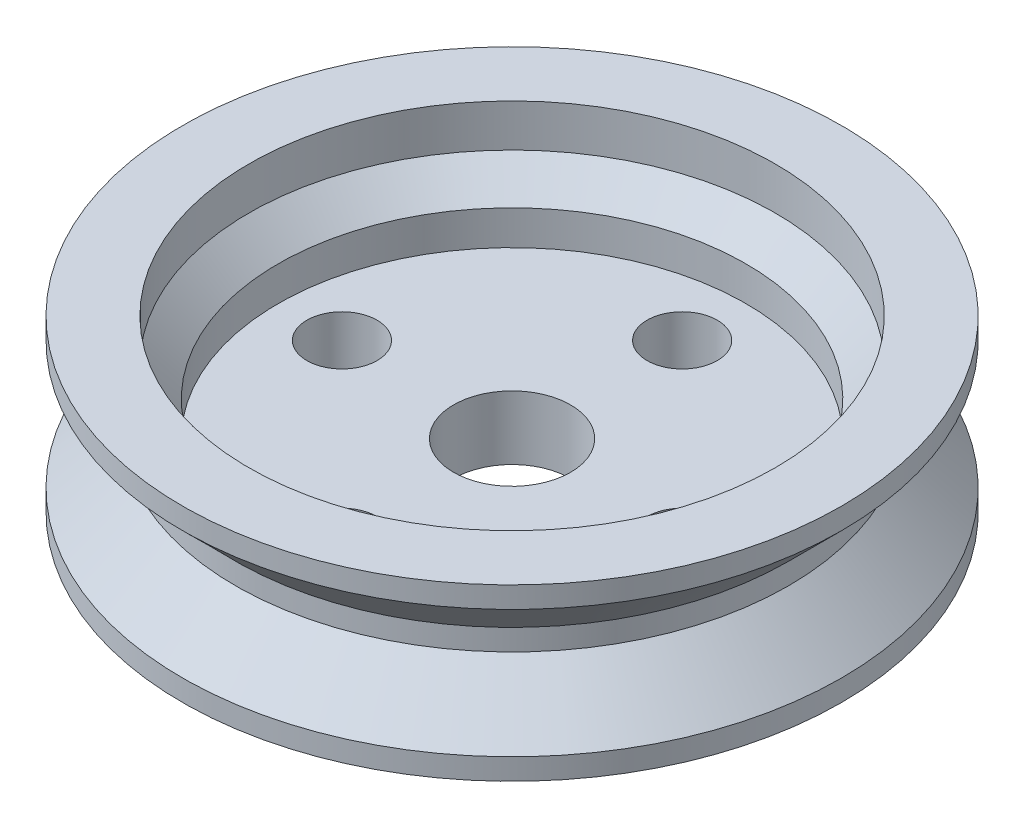
from build123d import *

# Parameters (mm, degrees)
SKETCH_3_R          = 2.75
SKETCH_3_R_2        = 1.65
CUT_EXTRUDE_1_DEPTH = 24.334523779


with BuildPart() as part:
    # 草图2 → 旋转1 (revolve)
    with BuildSketch(Plane.XY):
        Polygon((0, 0), (-15.5, 0), (-15.5, 1), (-13, 3.5), (-13, 4.5), (-15.5, 7), (-15.5, 8), (-12.378679656, 8), (-12.378679656, 6), (-11, 4.621320344), (-11, 3), (0, 3), (0, 1.5), align=None)
    revolve(axis=Axis((0, 0, 0), (0, 1, 0)))

    # 草图3 → 切除-拉伸1 (cut, through all)
    with BuildSketch(Plane.XZ):
        Circle(SKETCH_3_R)
        with Locations((0, 8)):
            Circle(SKETCH_3_R_2)
        with Locations((8, 0)):
            Circle(SKETCH_3_R_2)
        with Locations((0, -8)):
            Circle(SKETCH_3_R_2)
        with Locations((-8, 0)):
            Circle(SKETCH_3_R_2)
    extrude(amount=-CUT_EXTRUDE_1_DEPTH, mode=Mode.SUBTRACT)


solid = part.part
